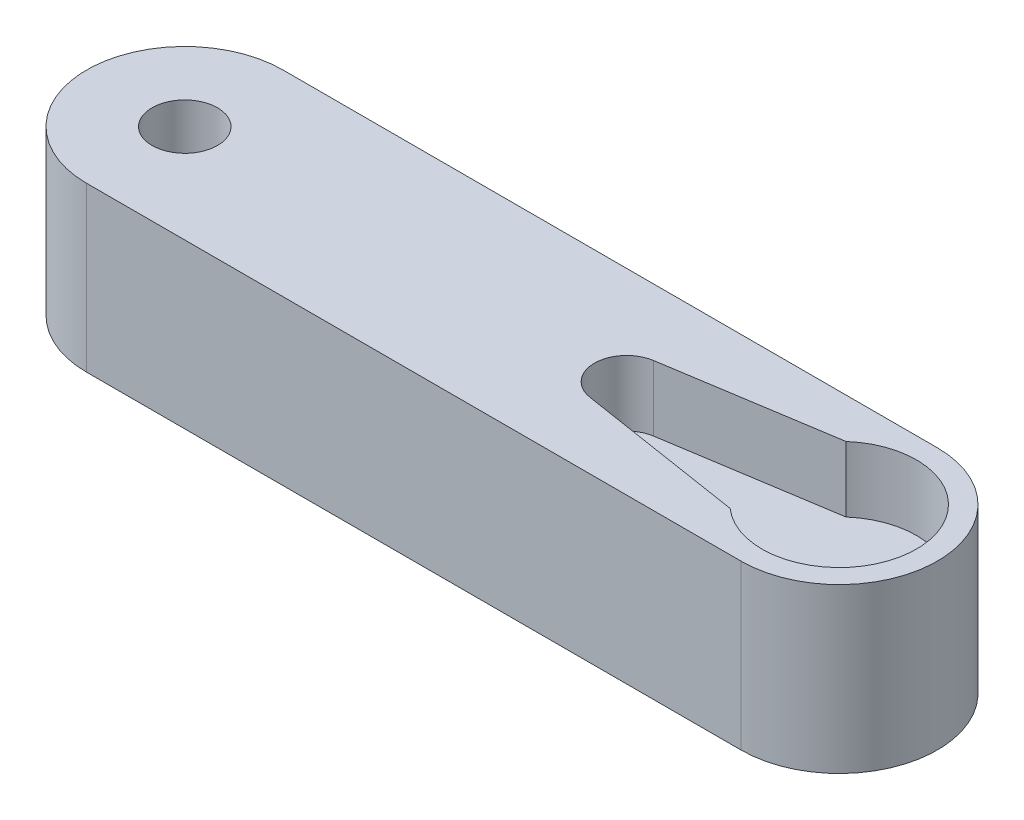
from build123d import *

# Parameters (mm, degrees)
BOSS_EXTRUDE1_DEPTH = 12.7
SKETCH4_R           = 2.54
CUT_EXTRUDE3_DEPTH  = 37.189429396
CUT_EXTRUDE4_DEPTH  = 5.08


with BuildPart() as part:
    # Sketch3 → Boss-Extrude1 (new body)
    with BuildSketch(Plane(origin=(0, 0, 0), x_dir=(1, 0, 0), z_dir=(0, 1, 0))):
        with BuildLine():
            Line((-25.4, 7.62), (25.4, 7.62))
            ThreePointArc((25.4, 7.62), (33.02, 0), (25.4, -7.62))
            Line((25.4, -7.62), (-25.4, -7.62))
            ThreePointArc((-25.4, -7.62), (-33.02, 0), (-25.4, 7.62))
        make_face()
    extrude(amount=BOSS_EXTRUDE1_DEPTH)

    # Sketch4 → Cut-Extrude3 (cut, through all)
    with BuildSketch(Plane(origin=(0, 12.7, 0), x_dir=(1, 0, 0), z_dir=(0, 1, 0))):
        with Locations(Location((-25.4, 0, 0), (0, 0, 270))):
            Circle(SKETCH4_R)
    extrude(amount=-CUT_EXTRUDE3_DEPTH, mode=Mode.SUBTRACT)

    # Sketch5 → Cut-Extrude4 (cut)
    with BuildSketch(Plane(origin=(0, 12.7, 0), x_dir=(1, 0, 0), z_dir=(0, 1, 0))):
        with BuildLine():
            Line((8.511876683, -2.469691065), (21.43137089, -4.50000243))
            ThreePointArc((21.43137089, -4.50000243), (31.40000324, 0), (21.43137089, 4.50000243))
            Line((21.43137089, 4.50000243), (8.511876683, 2.469691065))
            ThreePointArc((8.511876683, 2.469691065), (6.39998974, 0), (8.511876683, -2.469691065))
        make_face()
    extrude(amount=-CUT_EXTRUDE4_DEPTH, mode=Mode.SUBTRACT)


solid = part.part
